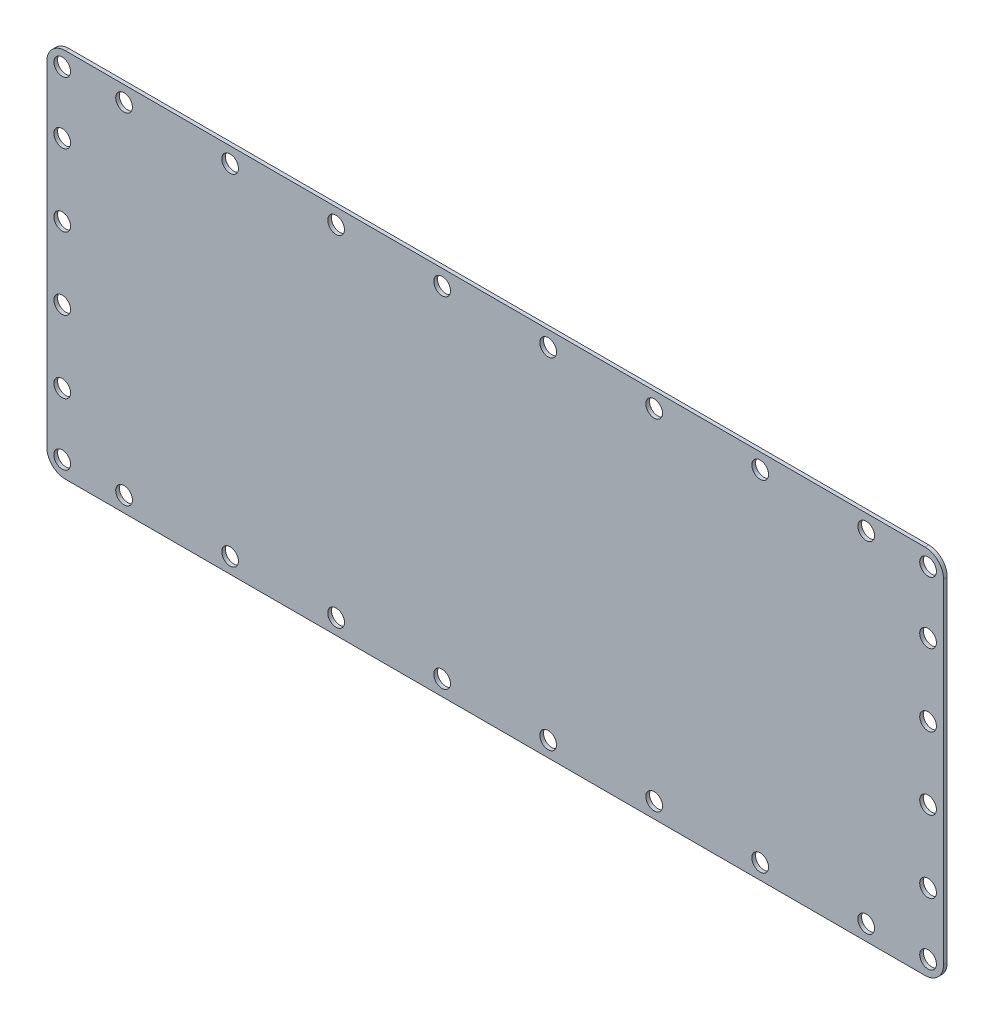
from build123d import *

# Parameters (mm, degrees)
SKETCH1_W           = 145
SKETCH1_H           = 60
BOSS_EXTRUDE1_DEPTH = 0.6
FILLET1_R           = 3
SKETCH2_R           = 1.35
CUT_EXTRUDE1_DEPTH  = 79.46406821


with BuildPart() as part:
    # Sketch1 → Boss-Extrude1 (new body)
    with BuildSketch(Plane.XY):
        Rectangle(SKETCH1_W, SKETCH1_H)
    extrude(amount=BOSS_EXTRUDE1_DEPTH)

    # Fillet1
    fillet1_edges = [part.edges().sort_by_distance(p)[0] for p in [
        (72.5, -30, 0.3),
        (-72.5, -30, 0.3),
        (-72.5, 30, 0.3),
        (72.5, 30, 0.3),
    ]]
    fillet(fillet1_edges, radius=FILLET1_R)

    # Sketch2 → Cut-Extrude1 (cut, through all)
    with BuildSketch(Plane.XY.offset(0.6)):
        with Locations((60, -27.5)):
            Circle(SKETCH2_R)
        with Locations((42.857142857, -27.5)):
            Circle(SKETCH2_R)
        with Locations((25.714285714, -27.5)):
            Circle(SKETCH2_R)
        with Locations((8.571428571, -27.5)):
            Circle(SKETCH2_R)
        with Locations((-8.571428571, -27.5)):
            Circle(SKETCH2_R)
        with Locations((-25.714285714, -27.5)):
            Circle(SKETCH2_R)
        with Locations((-42.857142857, -27.5)):
            Circle(SKETCH2_R)
        with Locations((-60, -27.5)):
            Circle(SKETCH2_R)
        with Locations((-70, -27.5)):
            Circle(SKETCH2_R)
        with Locations((-70, -17.5)):
            Circle(SKETCH2_R)
        with Locations((-70, -5.833333333)):
            Circle(SKETCH2_R)
        with Locations((-70, 5.833333333)):
            Circle(SKETCH2_R)
        with Locations((-70, 17.5)):
            Circle(SKETCH2_R)
        with Locations((-70, 27.5)):
            Circle(SKETCH2_R)
        with Locations((-60, 27.5)):
            Circle(SKETCH2_R)
        with Locations((-42.857142857, 27.5)):
            Circle(SKETCH2_R)
        with Locations((-25.714285714, 27.5)):
            Circle(SKETCH2_R)
        with Locations((-8.571428571, 27.5)):
            Circle(SKETCH2_R)
        with Locations((8.571428571, 27.5)):
            Circle(SKETCH2_R)
        with Locations((25.714285714, 27.5)):
            Circle(SKETCH2_R)
        with Locations((42.857142857, 27.5)):
            Circle(SKETCH2_R)
        with Locations((60, 27.5)):
            Circle(SKETCH2_R)
        with Locations((70, -27.5)):
            Circle(SKETCH2_R)
        with Locations((70, -17.5)):
            Circle(SKETCH2_R)
        with Locations((70, -5.833333333)):
            Circle(SKETCH2_R)
        with Locations((70, 5.833333333)):
            Circle(SKETCH2_R)
        with Locations((70, 17.5)):
            Circle(SKETCH2_R)
        with Locations((70, 27.5)):
            Circle(SKETCH2_R)
    extrude(amount=-CUT_EXTRUDE1_DEPTH, mode=Mode.SUBTRACT)


solid = part.part
